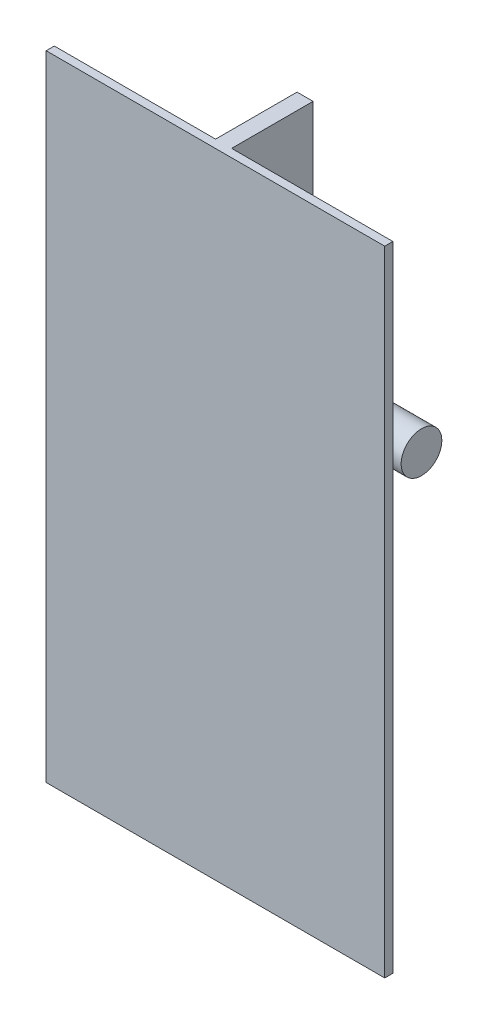
from build123d import *

# Parameters (mm, degrees)
SKETCH1_W           = 211.164618672
SKETCH1_H           = 395.262656468
BOSS_EXTRUDE1_DEPTH = 5.08
SKETCH2_W           = 10
SKETCH2_H           = 395.262656468
BOSS_EXTRUDE2_DEPTH = 50.8
SKETCH3_R           = 12.7
CUT_EXTRUDE1_DEPTH  = 15
SKETCH5_W           = 7.562322901
SKETCH5_H           = 100.104165791
BOSS_EXTRUDE3_DEPTH = 30
CUT_EXTRUDE4_DEPTH  = 20
SKETCH13_R          = 12.7
BOSS_EXTRUDE4_DEPTH = 50
SKETCH15_R          = 12.7
BOSS_EXTRUDE5_DEPTH = 50
SKETCH16_R          = 12.7
BOSS_EXTRUDE6_DEPTH = 50
SKETCH17_R          = 12.7
BOSS_EXTRUDE7_DEPTH = 50


with BuildPart() as part:
    # Sketch1 → Boss-Extrude1 (new body)
    with BuildSketch(Plane.XY):
        with Locations((-0.002292742, -3.867122219)):
            Rectangle(SKETCH1_W, SKETCH1_H)
    extrude(amount=BOSS_EXTRUDE1_DEPTH)

    # Sketch2 → Boss-Extrude2 (add)
    with BuildSketch(Plane(origin=(0, 0, 0), x_dir=(-1, 0, 0), z_dir=(0, 0, -1))):
        with Locations((0, -3.867122219)):
            Rectangle(SKETCH2_W, SKETCH2_H)
    extrude(amount=BOSS_EXTRUDE2_DEPTH)

    # Sketch3 → Cut-Extrude1 (cut)
    with BuildSketch(Plane(origin=(5, 0, 0), x_dir=(0, 0, -1), z_dir=(1, 0, 0))):
        with Locations((26.709107081, -90.757809842)):
            Circle(SKETCH3_R)
    extrude(amount=-CUT_EXTRUDE1_DEPTH, mode=Mode.SUBTRACT)

    # Sketch5 → Boss-Extrude3 (add)
    with BuildSketch(Plane(origin=(0, 0, -50.8), x_dir=(-1, 0, 0), z_dir=(0, 0, -1))):
        with Locations((0.273809221, 13.868484909)):
            Rectangle(SKETCH5_W, SKETCH5_H)
    extrude(amount=BOSS_EXTRUDE3_DEPTH)

    # Sketch12 → Cut-Extrude4 (cut)
    with BuildSketch(Plane(origin=(3.50735223, 0, 0), x_dir=(0, 0, -1), z_dir=(1, 0, 0))):
        Polygon((80.8, 13.868484908), (65.8, -36.183597987), (80.8, -36.183597987), align=None)
        Polygon((50.8, 22.859119742), (80.8, 13.868484908), (80.8, 63.920567804), (50.8, 63.920567804), align=None)
    extrude(amount=-CUT_EXTRUDE4_DEPTH, mode=Mode.SUBTRACT)

    # Sketch13 → Boss-Extrude4 (add)
    with BuildSketch(Plane.ZY.offset(4.054970671)):
        with Locations(Location((-69.744112894, 15.746525461, 0), (0, 0, 225.477498296))):
            Circle(SKETCH13_R)
    extrude(amount=BOSS_EXTRUDE4_DEPTH)


with BuildPart() as body_2:
    # Sketch15 → Boss-Extrude5 (new body)
    with BuildSketch(Plane(origin=(3.50735223, 0, 0), x_dir=(0, 0, -1), z_dir=(1, 0, 0))):
        with Locations((69.904821155, 18.963016363)):
            Circle(SKETCH15_R)
    extrude(amount=BOSS_EXTRUDE5_DEPTH)


with BuildPart() as body_3:
    # Sketch16 → Boss-Extrude6 (new body)
    with BuildSketch(Plane(origin=(5, 0, 0), x_dir=(0, 0, -1), z_dir=(1, 0, 0))):
        with Locations((26.709107081, -90.757809842)):
            Circle(SKETCH16_R)
    extrude(amount=BOSS_EXTRUDE6_DEPTH)


with BuildPart() as body_4:
    # Sketch17 → Boss-Extrude7 (new body)
    with BuildSketch(Plane.ZY.offset(5)):
        with Locations((-26.709107081, -90.757809842)):
            Circle(SKETCH17_R)
    extrude(amount=BOSS_EXTRUDE7_DEPTH)


solid = Compound([part.part, body_2.part, body_3.part, body_4.part])
